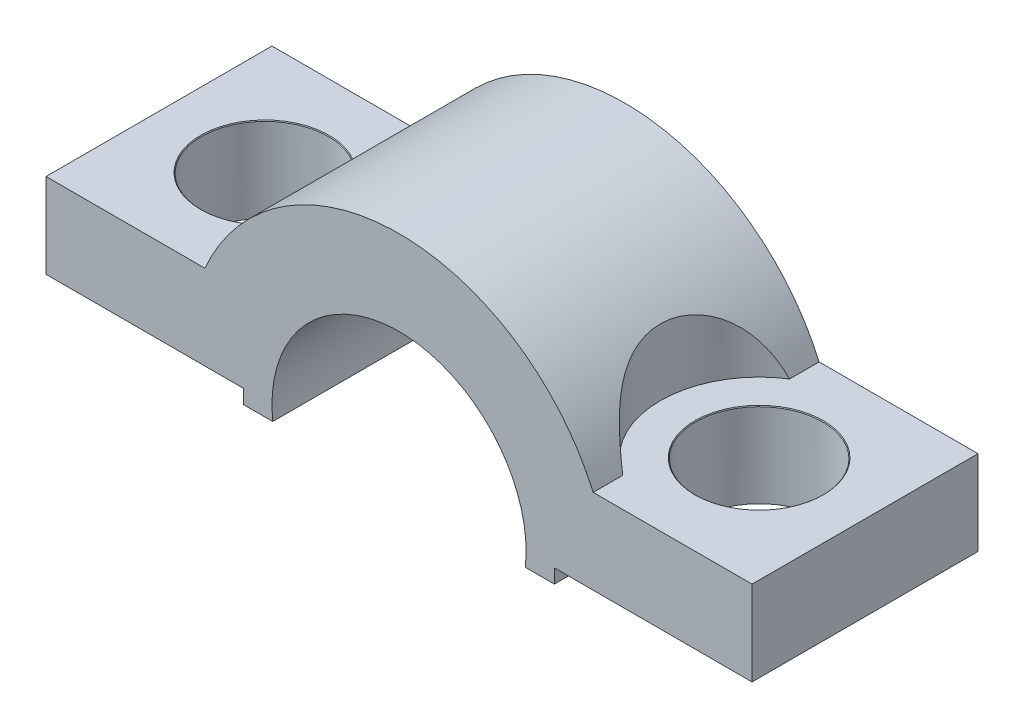
from build123d import *

# Parameters (mm, degrees)
EXTRUDE_1_DEPTH             = 8
HOLE_WIZARD_M4_1_AT_2_COUNT = 2
HOLE_WIZARD_M4_1_AT_2_PITCH = 17.5
EXTRUDE_START               = -4
EXTRUDE_3_DEPTH             = 4
SKETCH_7_R                  = 4.5
CUT_EXTRUDE_1_DEPTH         = 1
SKETCH_8_R                  = 3.5
CUT_EXTRUDE_2_DEPTH         = 10
SKETCH_10_R                 = 4.5
CUT_EXTRUDE_3_DEPTH         = 17.170961718


with BuildPart() as part:
    # 草图1 → 凸台-拉伸1 (new body)
    with BuildSketch(Plane.XY):
        with BuildLine():
            Line((5.5, 0), (12.5, 0))
            Line((12.5, 0), (12.5, 3))
            Line((12.5, 3), (6.873863542, 3))
            ThreePointArc((6.873863542, 3), (0, 7.5), (-6.873863542, 3))
            Line((-6.873863542, 3), (-12.5, 3))
            Line((-12.5, 3), (-12.5, 0))
            Line((-12.5, 0), (-5.5, 0))
            Line((-5.5, 0), (-5.5, -0.5))
            Line((-5.5, -0.5), (-4.00894001, -0.5))
            ThreePointArc((-4.00894001, -0.5), (0, 4.04), (4.00894001, -0.5))
            Line((4.00894001, -0.5), (5.5, -0.5))
            Line((5.5, -0.5), (5.5, 0))
        make_face()
    extrude(amount=EXTRUDE_1_DEPTH)

    # 草图5 → M4 间隙孔1 (revolve, cut)
    with BuildSketch(Plane(origin=(-8.75, 3, 4), x_dir=(0, 0, 1), z_dir=(1, 0, 0))):
        Polygon((0, 0), (0, 4.501936393), (2.25, 3.15), (2.25, 0.025), (2.275, 0), align=None)
    hole_wizard_m4_1 = revolve(axis=Axis((-8.75, 9.35, 4), (0, -1, 0)), mode=Mode.SUBTRACT)

    # M4 间隙孔1 at 2: M4 间隙孔1 ×2
    with Locations(*[(i * HOLE_WIZARD_M4_1_AT_2_PITCH, 0, 0) for i in range(1, HOLE_WIZARD_M4_1_AT_2_COUNT)]):
        add(hole_wizard_m4_1, mode=Mode.SUBTRACT)

    # 草图6 → 凸台-拉伸3 (add)
    with BuildSketch(Plane.XY.offset(8).offset(EXTRUDE_START)):
        with BuildLine():
            Line((-4.00894001, -0.5), (-3.464101615, -0.5))
            ThreePointArc((-3.464101615, -0.5), (0, 3.5), (3.464101615, -0.5))
            Line((3.464101615, -0.5), (4.00894001, -0.5))
            ThreePointArc((4.00894001, -0.5), (0, 4.04), (-4.00894001, -0.5))
        make_face()
    extrude(amount=EXTRUDE_3_DEPTH)

    # 草图7 → 切除-拉伸1 (cut)
    with BuildSketch(Plane(origin=(0, 0, 0), x_dir=(-1, 0, 0), z_dir=(0, 0, -1))):
        Circle(SKETCH_7_R)
    extrude(amount=-CUT_EXTRUDE_1_DEPTH, mode=Mode.SUBTRACT)

    # 草图8 → 切除-拉伸2 (cut)
    with BuildSketch(Plane(origin=(0, 3, 0), x_dir=(1, 0, 0), z_dir=(0, 1, 0))):
        with Locations((-8.75, -4)):
            Circle(SKETCH_8_R)
    cut_extrude_2 = extrude(amount=CUT_EXTRUDE_2_DEPTH, mode=Mode.SUBTRACT)

    # 镜向1: 切除-拉伸2 across plane
    add(cut_extrude_2.mirror(Plane(origin=(0, 0, 0), x_dir=(0, 0, 1), z_dir=(1, 0, 0))), mode=Mode.SUBTRACT)

    # 草图10 → 切除-拉伸3 (cut, through all)
    with BuildSketch(Plane(origin=(0, 0, 1), x_dir=(-1, 0, 0), z_dir=(0, 0, -1))):
        Circle(SKETCH_10_R)
    extrude(amount=-CUT_EXTRUDE_3_DEPTH, mode=Mode.SUBTRACT)


solid = part.part
